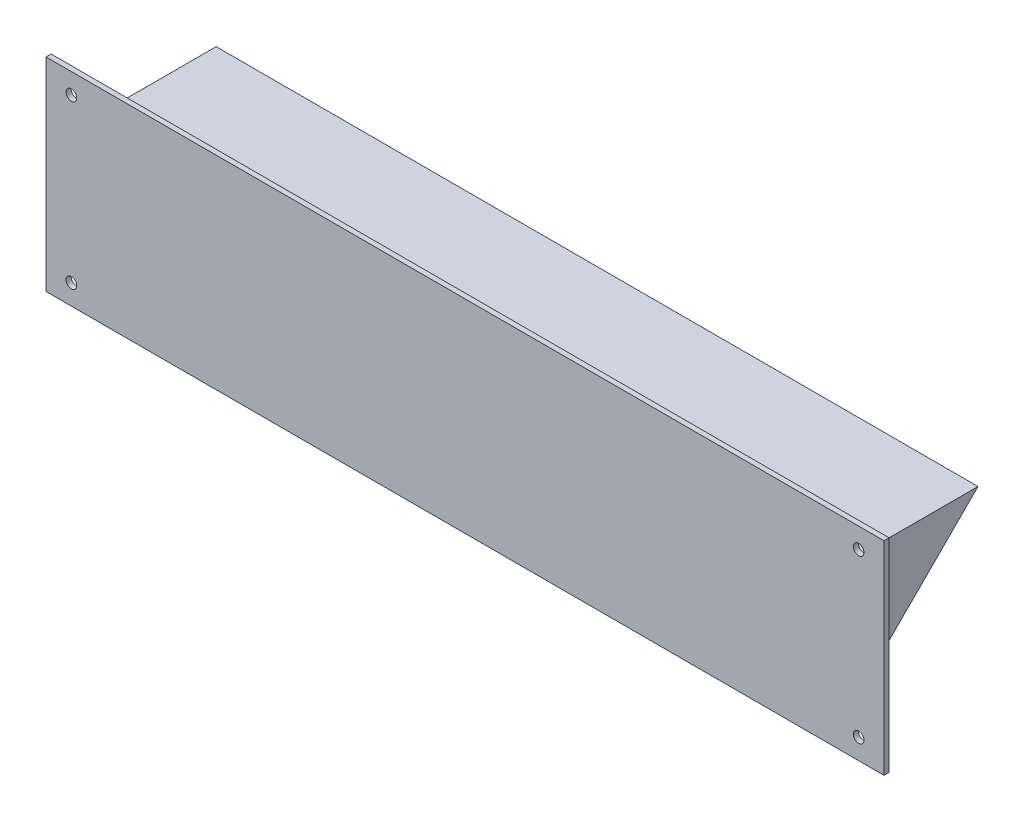
from build123d import *

# Parameters (mm, degrees)
SKETCH_1_W          = 330
SKETCH_1_H          = 80
EXTRUDE_1_DEPTH     = 2
HOLE_WIZARD_M5_1_D  = 4.2
EXTRUDE_2_DEPTH     = 150
SKETCH_6_R          = 21.213203436
CUT_EXTRUDE_1_DEPTH = 280


with BuildPart() as part:
    # 草图1 → 凸台-拉伸1 (new body)
    with BuildSketch(Plane.XY):
        Rectangle(SKETCH_1_W, SKETCH_1_H)
    extrude(amount=EXTRUDE_1_DEPTH)

    # M5 螺纹孔1 (through all)
    with Locations(Plane.XY.offset(2)):
        with Locations((-155, 32), (-155, -32), (155, 32), (155, -32)):
            Hole(HOLE_WIZARD_M5_1_D / 2)

    # 草图5 → 凸台-拉伸2 (add, symmetric)
    with BuildSketch(Plane(origin=(0, 0, 0), x_dir=(0, 0, -1), z_dir=(1, 0, 0))):
        Polygon((0, 25), (0, -25), (50, 25), align=None)
    extrude(amount=EXTRUDE_2_DEPTH, both=True)

    # 草图6 → 切除-拉伸1 (cut)
    with BuildSketch(Plane(origin=(140, 0, 0), x_dir=(0, 0, -1), z_dir=(1, 0, 0))):
        with Locations((25, 0)):
            Circle(SKETCH_6_R)
    extrude(amount=-CUT_EXTRUDE_1_DEPTH, mode=Mode.SUBTRACT)


solid = part.part
